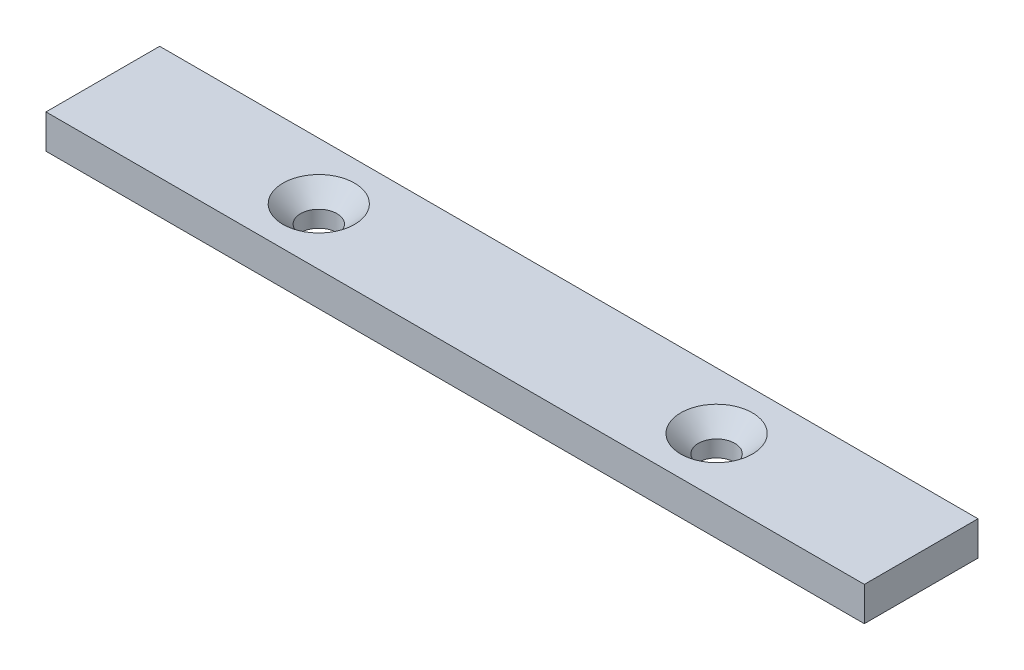
from build123d import *

# Parameters (mm, degrees)
SKETCH1_W                                      = 144
SKETCH1_H                                      = 20
BOSS_EXTRUDE1_DEPTH                            = 6
CSK_FOR_M6_FLAT_HEAD_MACHINE_SCREW1_AT_2_COUNT = 2
CSK_FOR_M6_FLAT_HEAD_MACHINE_SCREW1_AT_2_PITCH = 70


with BuildPart() as part:
    # Sketch1 → Boss-Extrude1 (new body)
    with BuildSketch(Plane(origin=(0, 0, 0), x_dir=(1, 0, 0), z_dir=(0, 1, 0))):
        Rectangle(SKETCH1_W, SKETCH1_H)
    extrude(amount=BOSS_EXTRUDE1_DEPTH)

    # Sketch3 → CSK for M6 Flat Head Machine Screw1 (revolve, cut)
    with BuildSketch(Plane(origin=(-34, 6, 0), x_dir=(0, 0, 1), z_dir=(1, 0, 0))):
        Polygon((0, 0), (0, 6), (3.2, 6), (3.2, 3.1), (6.3, 0), align=None)
    csk_for_m6_flat_head_machine_screw1 = revolve(axis=Axis((-34, 12.35, 0), (0, -1, 0)), mode=Mode.SUBTRACT)

    # CSK for M6 Flat Head Machine Screw1 at 2: CSK for M6 Flat Head Machine Screw1 ×2
    with Locations(*[(i * CSK_FOR_M6_FLAT_HEAD_MACHINE_SCREW1_AT_2_PITCH, 0, 0) for i in range(1, CSK_FOR_M6_FLAT_HEAD_MACHINE_SCREW1_AT_2_COUNT)]):
        add(csk_for_m6_flat_head_machine_screw1, mode=Mode.SUBTRACT)


solid = part.part
